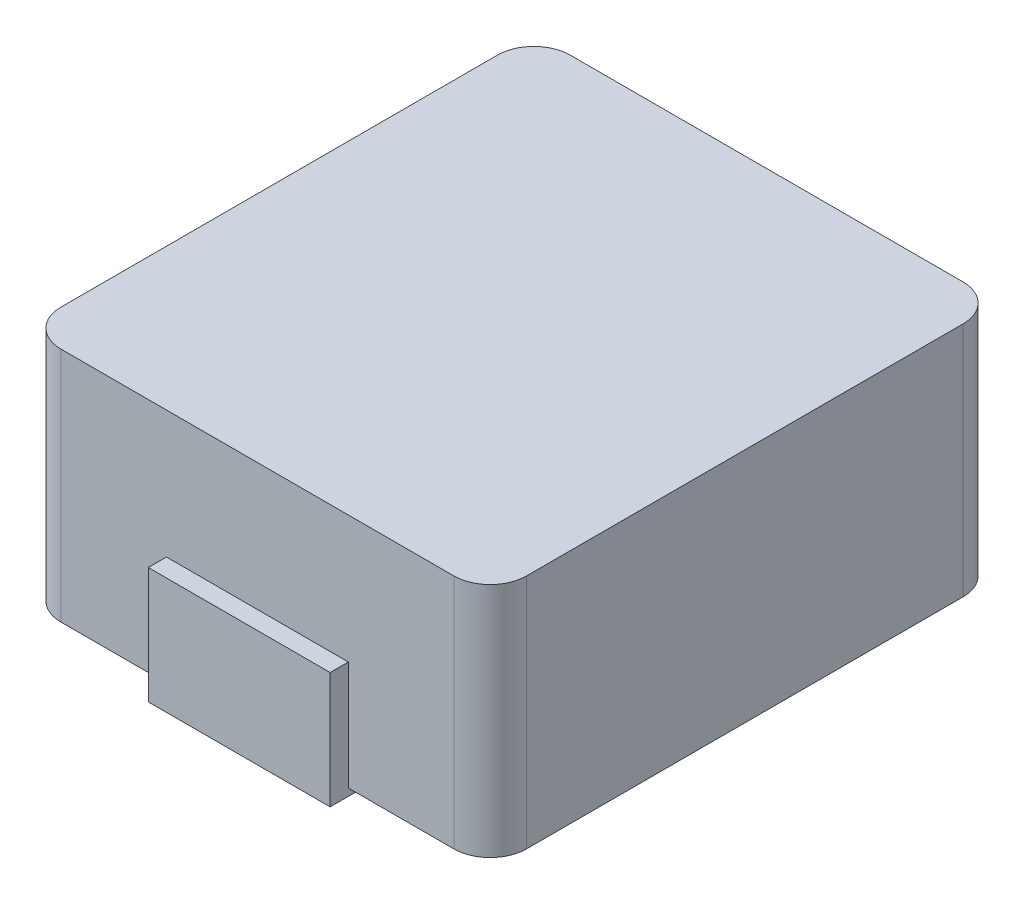
from build123d import *

# Parameters (mm, degrees)
SKETCH1_W                = 12.8
SKETCH1_H                = 14
BOSS_EXTRUDE1_DEPTH      = 6.5
FILLET1_R                = 1
BOSS_EXTRUDE2_DEPTH      = 0.2
BOSS_EXTRUDE2_DEPTH_BACK = 3


with BuildPart() as part:
    # Sketch1 → Boss-Extrude1 (new body)
    with BuildSketch(Plane(origin=(0, 0, 0), x_dir=(1, 0, 0), z_dir=(0, 1, 0))):
        with Locations((6.4, 7)):
            Rectangle(SKETCH1_W, SKETCH1_H)
    extrude(amount=BOSS_EXTRUDE1_DEPTH)

    # Fillet1
    fillet1_edges = [part.edges().sort_by_distance(p)[0] for p in [
        (0, 3.25, 0),
        (0, 3.25, -14),
        (12.8, 3.25, -14),
        (12.8, 3.25, 0),
    ]]
    fillet(fillet1_edges, radius=FILLET1_R)

    # Sketch2 → Boss-Extrude2 (add, two sides: drawn at the far end of the back side and taken through both)
    with BuildSketch(Plane.XZ.offset(-BOSS_EXTRUDE2_DEPTH_BACK)):
        Polygon((8.9, 0), (8.9, -2.6), (3.9, -2.6), (3.9, 0.5), (8.9, 0.5), align=None)
        Polygon((3.9, -14.5), (8.9, -14.5), (8.9, -14), (8.9, -11.4), (3.9, -11.4), align=None)
    extrude(amount=BOSS_EXTRUDE2_DEPTH + BOSS_EXTRUDE2_DEPTH_BACK)


solid = part.part
